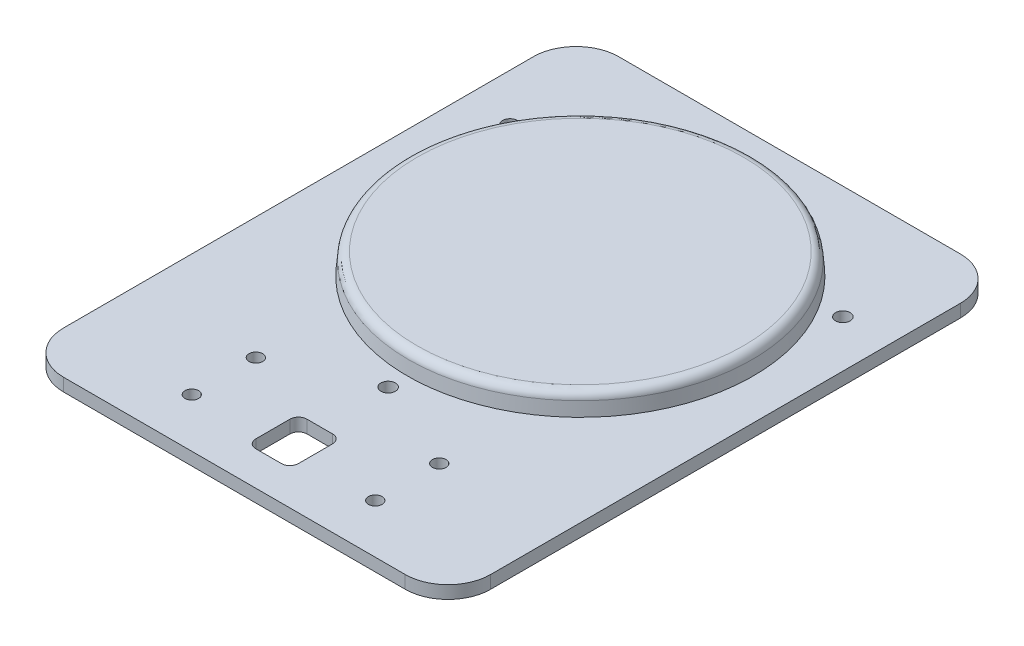
from build123d import *

# Parameters (mm, degrees)
SKETCH1_R           = 1.6
SKETCH1_R_2         = 1.7
BOSS_EXTRUDE1_DEPTH = 3
SKETCH2_R           = 40.5
BOSS_EXTRUDE2_DEPTH = 5
BOSS_EXTRUDE2_TAPER = 5
FILLET1_R           = 2


with BuildPart() as part:
    # Sketch1 → Boss-Extrude1 (new body)
    with BuildSketch(Plane(origin=(0, 0, 0), x_dir=(1, 0, 0), z_dir=(0, 1, 0))):
        with BuildLine():
            Line((40, -65), (-40, -65))
            ThreePointArc((-40, -65), (-47.071067812, -62.071067812), (-50, -55))
            Line((-50, -55), (-50, 55))
            ThreePointArc((-50, 55), (-47.071067812, 62.071067812), (-40, 65))
            Line((-40, 65), (40, 65))
            ThreePointArc((40, 65), (47.071067812, 62.071067812), (50, 55))
            Line((50, 55), (50, -55))
            ThreePointArc((50, -55), (47.071067812, -62.071067812), (40, -65))
        make_face()
        with Locations(Location((21.475, -38.5, 0), (0, 0, 270))):
            Circle(SKETCH1_R, mode=Mode.SUBTRACT)
        with Locations(Location((21.475, -53.5, 0), (0, 0, 270))):
            Circle(SKETCH1_R, mode=Mode.SUBTRACT)
        with Locations(Location((-21.475, -38.5, 0), (0, 0, 270))):
            Circle(SKETCH1_R, mode=Mode.SUBTRACT)
        with Locations(Location((-21.475, -53.5, 0), (0, 0, 270))):
            Circle(SKETCH1_R, mode=Mode.SUBTRACT)
        with Locations(Location((0, -29, 0), (0, 0, 270))):
            Circle(SKETCH1_R_2, mode=Mode.SUBTRACT)
        with Locations(Location((-38.97114317, 38.5, 0), (0, 0, 270))):
            Circle(SKETCH1_R_2, mode=Mode.SUBTRACT)
        with Locations(Location((38.97114317, 38.5, 0), (0, 0, 270))):
            Circle(SKETCH1_R_2, mode=Mode.SUBTRACT)
        with BuildLine():
            Line((3, -57), (-3, -57))
            ThreePointArc((-3, -57), (-4.414213562, -56.414213562), (-5, -55))
            Line((-5, -55), (-5, -47))
            ThreePointArc((-5, -47), (-4.414213562, -45.585786438), (-3, -45))
            Line((-3, -45), (3, -45))
            ThreePointArc((3, -45), (4.414213562, -45.585786438), (5, -47))
            Line((5, -47), (5, -55))
            ThreePointArc((5, -55), (4.414213562, -56.414213562), (3, -57))
        make_face(mode=Mode.SUBTRACT)
    extrude(amount=-BOSS_EXTRUDE1_DEPTH)

    # Sketch2 → Boss-Extrude2 (add)
    with BuildSketch(Plane(origin=(0, 0, 0), x_dir=(1, 0, 0), z_dir=(0, 1, 0))):
        with Locations((0, 16)):
            Circle(SKETCH2_R)
    extrude(amount=BOSS_EXTRUDE2_DEPTH, taper=BOSS_EXTRUDE2_TAPER)

    # Fillet1
    fillet1_edges = [part.edges().sort_by_distance(p)[0] for p in [
        (-40.062556682, 5, -16),
    ]]
    fillet(fillet1_edges, radius=FILLET1_R)


solid = part.part
